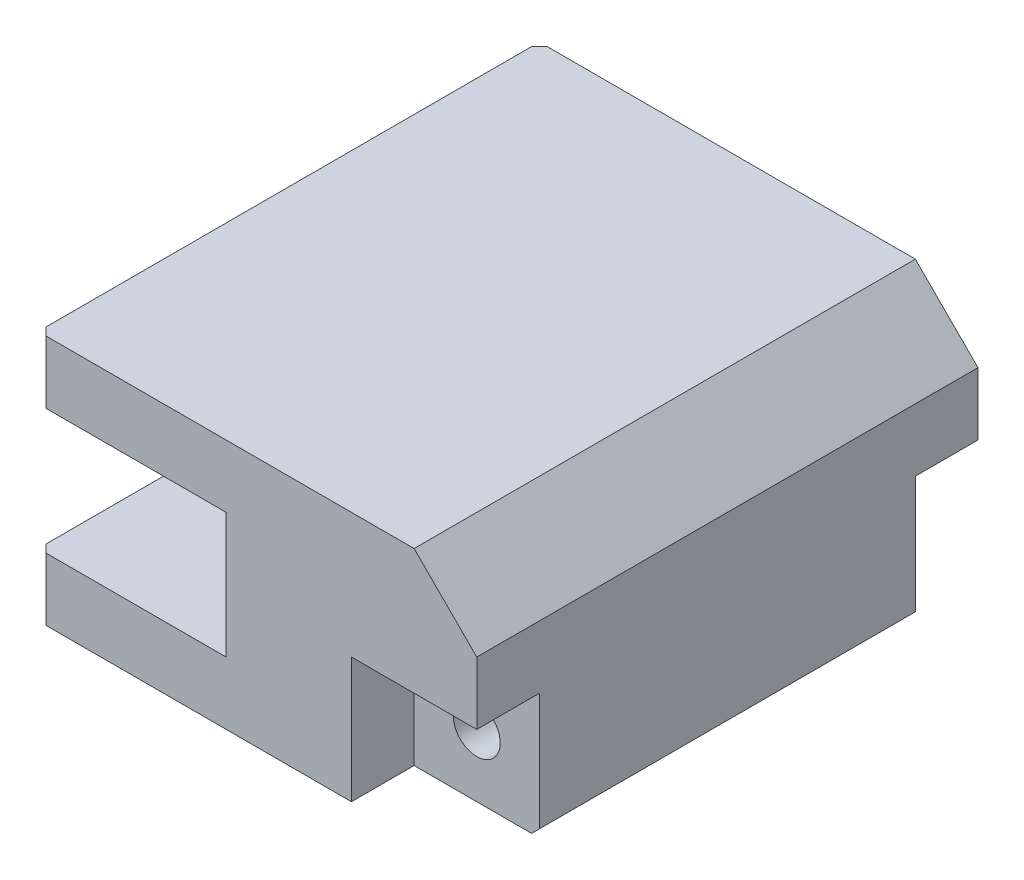
from build123d import *

# Parameters (mm, degrees)
SKETCH1_W           = 88.9
SKETCH1_H           = 50.8
BOSS_EXTRUDE1_DEPTH = 50.8
SKETCH2_W           = 25.4
SKETCH2_H           = 25.4
CUT_EXTRUDE1_DEPTH  = 12.7
SKETCH3_R           = 4.7625
CUT_EXTRUDE2_DEPTH  = 103.587389576
SKETCH4_W           = 38.1
SKETCH4_H           = 25.4
CUT_EXTRUDE3_DEPTH  = 114.769602707
CHAMFER1_SIZE       = 12.7
CHAMFER2_SIZE       = 1.5875


with BuildPart() as part:
    # Sketch1 → Boss-Extrude1 (new, symmetric)
    with BuildSketch(Plane.XY):
        Rectangle(SKETCH1_W, SKETCH1_H)
    extrude(amount=BOSS_EXTRUDE1_DEPTH, both=True)

    # Sketch2 → Cut-Extrude1 (cut)
    with BuildSketch(Plane.XY.offset(50.8)):
        with Locations((31.75, -12.7)):
            Rectangle(SKETCH2_W, SKETCH2_H)
    cut_extrude1 = extrude(amount=-CUT_EXTRUDE1_DEPTH, mode=Mode.SUBTRACT)

    # Sketch3 → Cut-Extrude2 (cut, through all)
    with BuildSketch(Plane.XY.offset(38.1)):
        with Locations((31.75, -12.7)):
            Circle(SKETCH3_R)
    extrude(amount=-CUT_EXTRUDE2_DEPTH, mode=Mode.SUBTRACT)

    # Mirror1: Cut-Extrude1 across plane
    add(cut_extrude1.mirror(Plane.XY), mode=Mode.SUBTRACT)

    # Sketch4 → Cut-Extrude3 (cut, through all)
    with BuildSketch(Plane.XY.offset(50.8)):
        with Locations((-25.4, 0)):
            Rectangle(SKETCH4_W, SKETCH4_H)
    extrude(amount=-CUT_EXTRUDE3_DEPTH, mode=Mode.SUBTRACT)

    # Chamfer1
    chamfer1_edges = [part.edges().sort_by_distance(p)[0] for p in [
        (44.45, 25.4, 0),
    ]]
    chamfer(chamfer1_edges, length=CHAMFER1_SIZE)

    # Chamfer2
    chamfer2_edges = [part.edges().sort_by_distance(p)[0] for p in [
        (44.45, -25.4, 0),
        (-44.45, 19.05, 50.8),
        (-44.45, -19.05, 50.8),
        (-44.45, -19.05, -50.8),
        (-44.45, 19.05, -50.8),
    ]]
    chamfer(chamfer2_edges, length=CHAMFER2_SIZE)


solid = part.part
